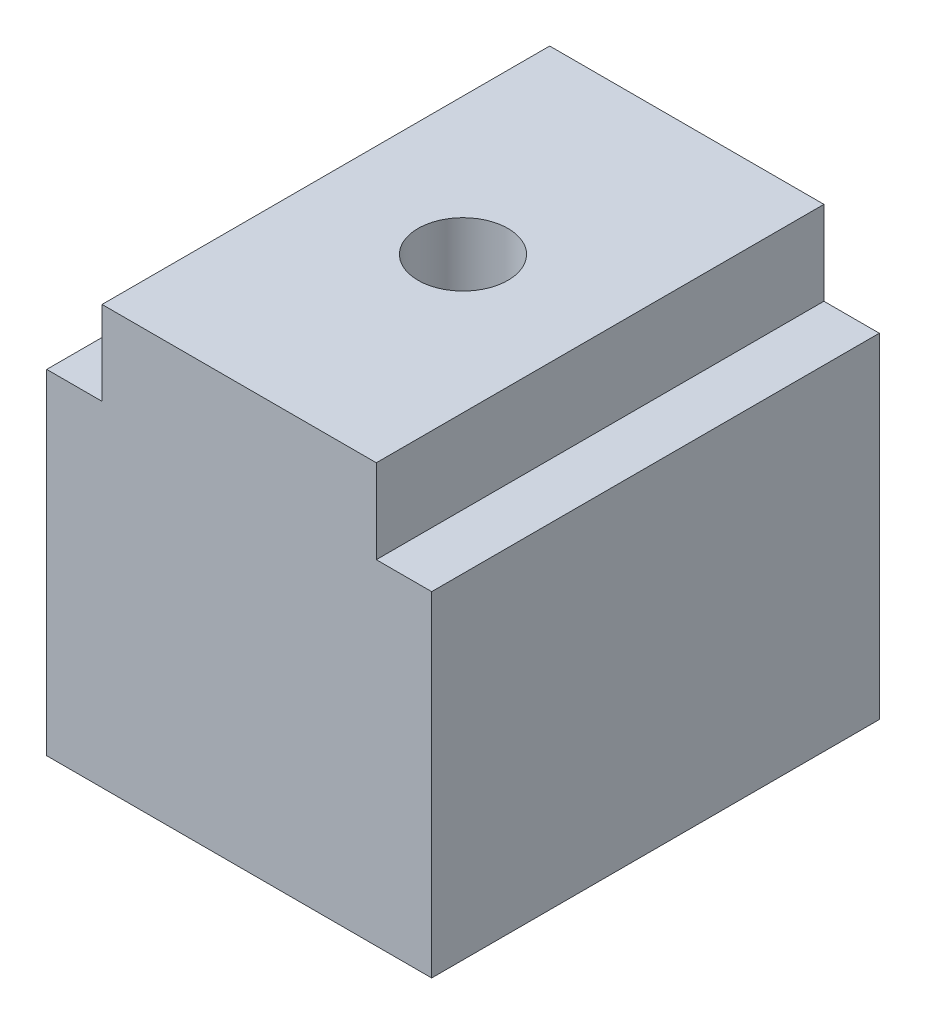
from build123d import *

# Parameters (mm, degrees)
SKETCH1_W                          = 21.844
SKETCH1_H                          = 25.4
BOSS_EXTRUDE1_DEPTH                = 23.749
CLEARANCE_HOLE_FOR_ALIGNMENT_PIN_D = 5.1054
SKETCH6_W                          = 3.140911286
SKETCH6_H                          = 25.4
CLEARANCE_RABBIT_DEPTH             = 4.7625


with BuildPart() as part:
    # Sketch1 → Boss-Extrude1 (new body)
    with BuildSketch(Plane(origin=(0, 0, 0), x_dir=(1, 0, 0), z_dir=(0, 1, 0))):
        Rectangle(SKETCH1_W, SKETCH1_H)
    extrude(amount=BOSS_EXTRUDE1_DEPTH)

    # Clearance Hole for Alignment Pin (through all)
    with Locations(Plane(origin=(0, 23.749, 0), x_dir=(1, 0, 0), z_dir=(0, 1, 0))):
        with Locations((0, 0)):
            Hole(CLEARANCE_HOLE_FOR_ALIGNMENT_PIN_D / 2)

    # Sketch6 → Clearance Rabbit (cut)
    with BuildSketch(Plane(origin=(0, 23.749, 0), x_dir=(1, 0, 0), z_dir=(0, 1, 0))):
        with Locations((9.351544357, 0)):
            Rectangle(SKETCH6_W, SKETCH6_H)
        with Locations((-9.351544357, 0)):
            Rectangle(SKETCH6_W, SKETCH6_H)
    extrude(amount=-CLEARANCE_RABBIT_DEPTH, mode=Mode.SUBTRACT)


solid = part.part
